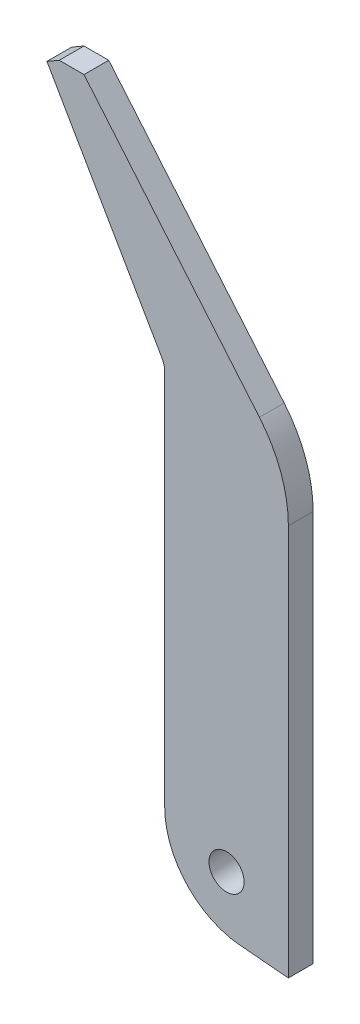
from build123d import *

# Parameters (mm, degrees)
SKETCH1_R      = 4.25
EXTRUDE1_DEPTH = 3
FILLET1_R      = 20


with BuildPart() as part:
    # Sketch1 → Extrude1 (new, symmetric)
    with BuildSketch(Plane.XY):
        with BuildLine():
            Line((0, 0), (0, 95))
            ThreePointArc((0, 95), (-1.809221376, 105.2606043), (-7.018666706, 114.283628291))
            Line((-7.018666706, 114.283628291), (-49.574755502, 165))
            Line((-49.574755502, 165), (-55.574755502, 165))
            Line((-55.574755502, 165), (-58.574755502, 163.267949192))
            Line((-58.574755502, 163.267949192), (-30.669872981, 114.935274886))
            ThreePointArc((-30.669872981, 114.935274886), (-30.170370869, 113.729370112), (-30, 112.435274886))
            Line((-30, 112.435274886), (-30, 2.624659906))
            Line((-30, 2.624659906), (0, 0))
        make_face()
        with Locations((-15, 14.8)):
            Circle(SKETCH1_R, mode=Mode.SUBTRACT)
    extrude(amount=EXTRUDE1_DEPTH, both=True)

    # Fillet1
    fillet1_edges = [part.edges().sort_by_distance(p)[0] for p in [
        (-30, 2.624659906, 0),
    ]]
    fillet(fillet1_edges, radius=FILLET1_R)


solid = part.part
